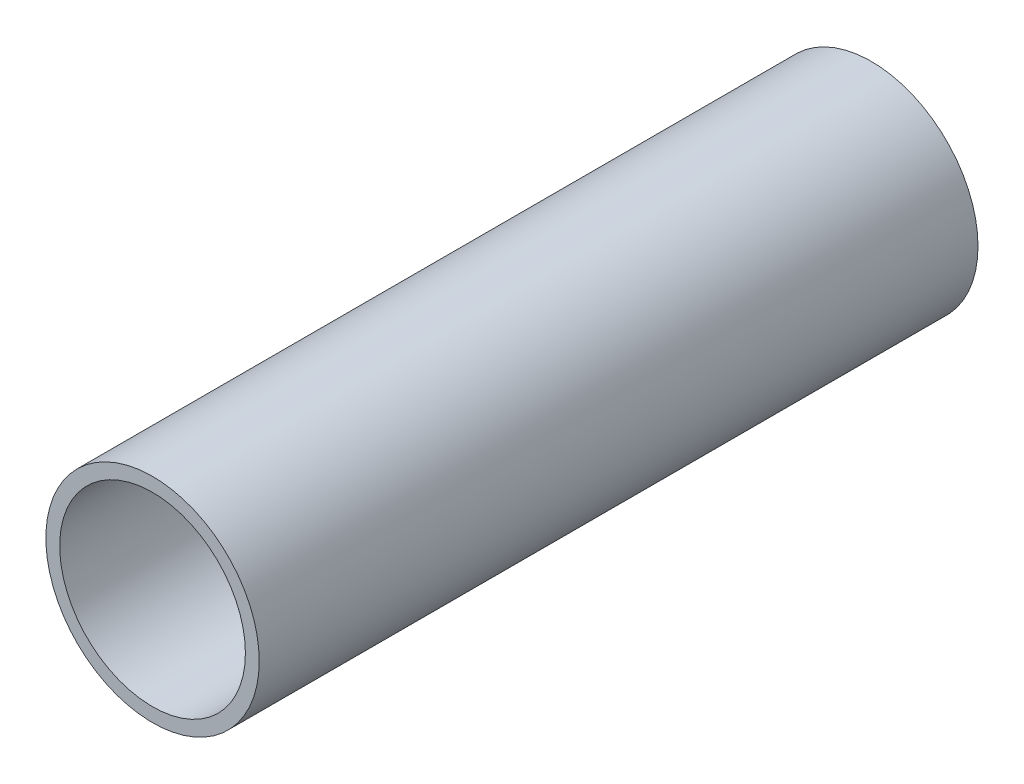
from build123d import *

# Parameters (mm, degrees)
SKETCH1_R           = 30.1625
SKETCH1_R_2         = 26.2509
EXTRUDE_THIN1_DEPTH = 101.6


with BuildPart() as part:
    # Sketch1 → Extrude-Thin1 (new, symmetric)
    with BuildSketch(Plane.XY):
        Circle(SKETCH1_R)
        Circle(SKETCH1_R_2, mode=Mode.SUBTRACT)
    extrude(amount=EXTRUDE_THIN1_DEPTH, both=True)


solid = part.part
